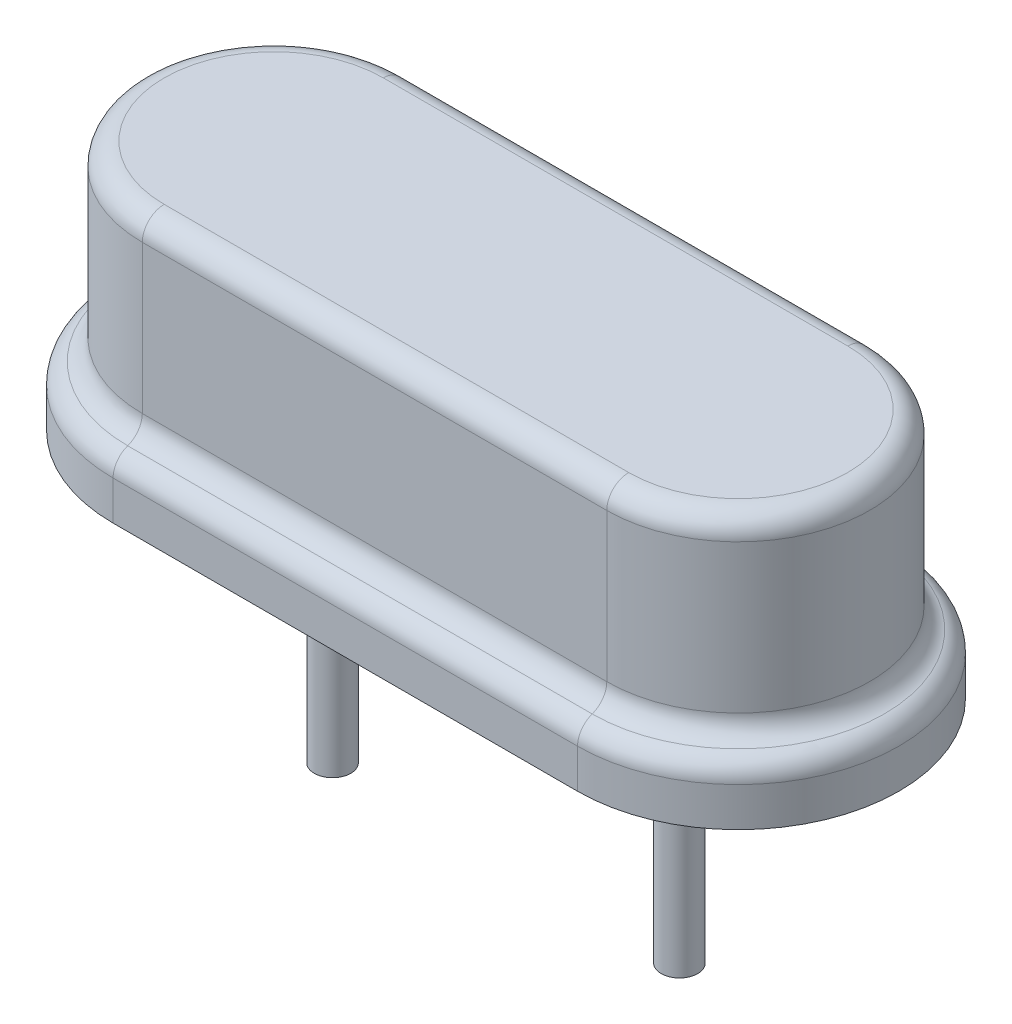
from build123d import *

# Parameters (mm, degrees)
SALIENTE_EXTRUIR1_DEPTH = 3.43
SALIENTE_EXTRUIR2_DEPTH = 0.8
REDONDEO2_R             = 0.3
REDONDEO5_R             = 0.3
CROQUIS2_R              = 0.25
SALIENTE_EXTRUIR3_DEPTH = 3.54


with BuildPart() as part:
    # Croquis1 → Saliente-Extruir1 (new body)
    with BuildSketch(Plane(origin=(0, 0, 0), x_dir=(1, 0, 0), z_dir=(0, 1, 0))):
        with BuildLine():
            Line((0, 0.4), (6.36, 0.4))
            ThreePointArc((6.36, 0.4), (8.16, 2.2), (6.36, 4))
            Line((6.36, 4), (0, 4))
            ThreePointArc((0, 4), (-1.8, 2.2), (0, 0.4))
        make_face()
    extrude(amount=SALIENTE_EXTRUIR1_DEPTH)

    # Croquis1<3> → Saliente-Extruir2 (add)
    with BuildSketch(Plane(origin=(0, 0, 0), x_dir=(1, 0, 0), z_dir=(0, 1, 0))):
        with BuildLine():
            Line((0, 0), (6.36, 0))
            ThreePointArc((6.36, 0), (8.56, 2.2), (6.36, 4.4))
            Line((6.36, 4.4), (0, 4.4))
            ThreePointArc((0, 4.4), (-2.2, 2.2), (0, 0))
        make_face()
        with BuildLine():
            Line((0, 0.4), (6.36, 0.4))
            ThreePointArc((6.36, 0.4), (8.16, 2.2), (6.36, 4))
            Line((6.36, 4), (0, 4))
            ThreePointArc((0, 4), (-1.8, 2.2), (0, 0.4))
        make_face(mode=Mode.SUBTRACT)
    extrude(amount=SALIENTE_EXTRUIR2_DEPTH)

    # Redondeo2
    redondeo2_edges = [part.edges().sort_by_distance(p)[0] for p in [
        (3.18, 3.43, -0.4),
        (8.16, 3.43, -2.2),
        (3.18, 3.43, -4),
        (-1.8, 3.43, -2.2),
        (-1.8, 0.8, -2.2),
        (3.18, 0.8, -4),
        (8.16, 0.8, -2.2),
        (3.18, 0.8, -0.4),
    ]]
    fillet(redondeo2_edges, radius=REDONDEO2_R)

    # Redondeo5
    redondeo5_edges = [part.edges().sort_by_distance(p)[0] for p in [
        (-2.2, 0.8, -2.2),
        (3.18, 0.8, -4.4),
        (8.56, 0.8, -2.2),
        (3.18, 0.8, 0),
    ]]
    fillet(redondeo5_edges, radius=REDONDEO5_R)

    # Croquis2 → Saliente-Extruir3 (add)
    with BuildSketch(Plane.XZ):
        with Locations((0.805, -2.2)):
            Circle(CROQUIS2_R)
        with Locations((5.555, -2.2)):
            Circle(CROQUIS2_R)
    extrude(amount=SALIENTE_EXTRUIR3_DEPTH)


solid = part.part
